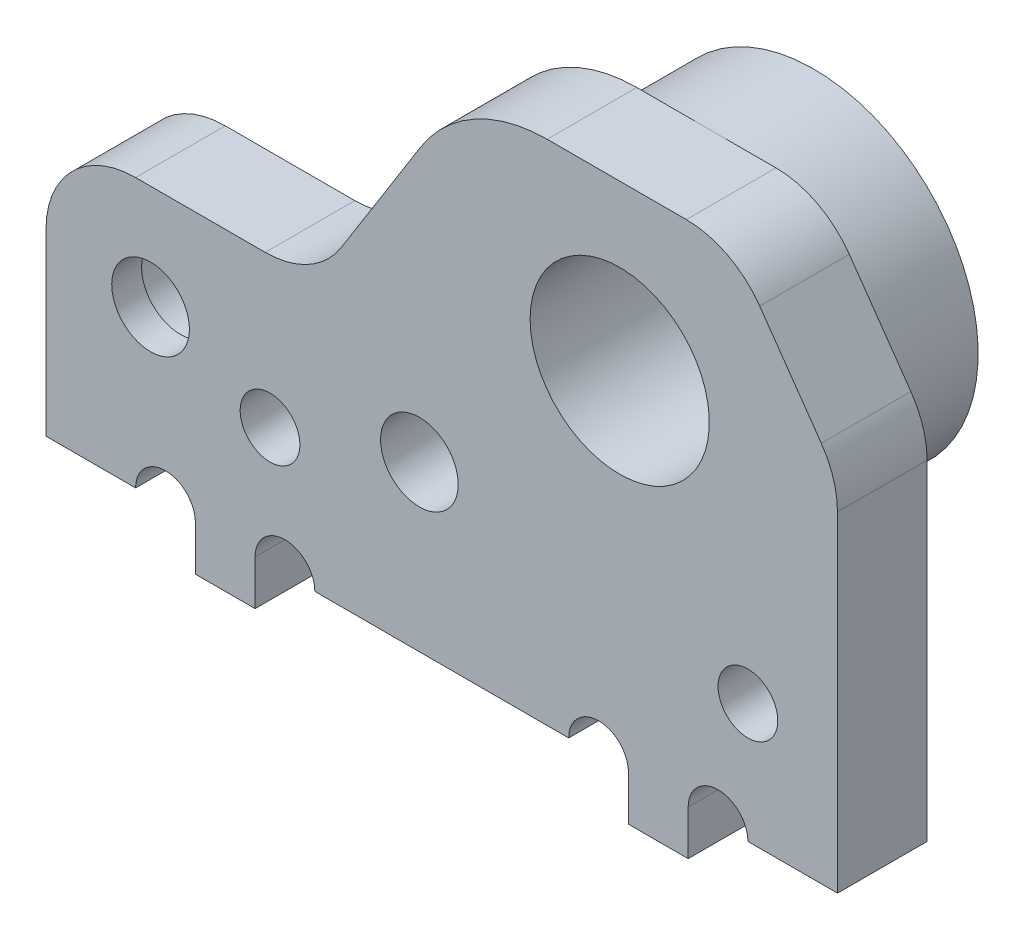
from build123d import *

# Parameters (mm, degrees)
SKETCH1_W                            = 26.5
SKETCH1_H                            = 6
BOSS_EXTRUDE1_DEPTH                  = 17
SKETCH2_R                            = 1.5
CUT_EXTRUDE1_DEPTH                   = 1
SKETCH3_R                            = 1.3
CUT_EXTRUDE2_DEPTH                   = 32.878676259
SKETCH4_R                            = 3
CUT_EXTRUDE3_DEPTH                   = 33.050741021
SKETCH5_R                            = 2.5
CUT_EXTRUDE4_DEPTH                   = 1.5
SKETCH6_R                            = 1.5
CUT_EXTRUDE8_DEPTH                   = 1
SKETCH7_R                            = 1.3
CUT_EXTRUDE9_DEPTH                   = 32.678068123
CUT_EXTRUDE10_START                  = -1
SKETCH8_R                            = 2.5
CUT_EXTRUDE10_DEPTH                  = 1
CUT_EXTRUDE11_START                  = -1
SKETCH9_R                            = 1.5
CUT_EXTRUDE11_DEPTH                  = 1
SKETCH10_R                           = 5.5
SKETCH10_R_2                         = 3
BOSS_EXTRUDE2_DEPTH                  = 3.5
SKETCH11_R                           = 3
SKETCH11_R_2                         = 1.3
BOSS_EXTRUDE4_DEPTH                  = 2
CUT_EXTRUDE12_START                  = -1
SKETCH12_R                           = 1.5
CUT_EXTRUDE12_DEPTH                  = 1
SKETCH17_W                           = 2
SKETCH17_H                           = 6
BOSS_EXTRUDE6_DEPTH                  = 1.5
SKETCH18_R                           = 1
CUT_EXTRUDE17_DEPTH                  = 33.050741021
CHAMFER2_SIZE                        = 5
CHAMFER2_SIZE2                       = 3.5
FILLET11_R                           = 3
BOSS_EXTRUDE7_DEPTH                  = 2
CUT_EXTRUDE19_DEPTH                  = 33.050741021
FILLET13_R                           = 5
FILLET14_R                           = 3
FILLET15_R                           = 3
SKIZZE1_R                            = 1
SCHNITT_LINEAR_AUSTRAGEN1_DEPTH      = 33.050741021
SCHNITT_LINEAR_AUSTRAGEN2_DEPTH      = 31.409702399
SCHNITT_LINEAR_AUSTRAGEN2_DEPTH_BACK = 31.409702399
SKIZZE2_W                            = 26.5
SKIZZE2_H                            = 3


with BuildPart() as part:
    # Sketch1 → Boss-Extrude1 (new body)
    with BuildSketch(Plane(origin=(0, 0, 0), x_dir=(1, 0, 0), z_dir=(0, 1, 0))):
        with Locations((13.25, 3)):
            Rectangle(SKETCH1_W, SKETCH1_H)
    extrude(amount=BOSS_EXTRUDE1_DEPTH)

    # Sketch2 → Cut-Extrude1 (cut)
    with BuildSketch(Plane.XY):
        with Locations((12.5, 5.5)):
            Circle(SKETCH2_R)
    extrude(amount=-CUT_EXTRUDE1_DEPTH, mode=Mode.SUBTRACT)

    # Sketch3 → Cut-Extrude2 (cut, through all)
    with BuildSketch(Plane.XY.offset(-1)):
        with Locations((12.5, 5.5)):
            Circle(SKETCH3_R)
    extrude(amount=-CUT_EXTRUDE2_DEPTH, mode=Mode.SUBTRACT)

    # Sketch4 → Cut-Extrude3 (cut, through all)
    with BuildSketch(Plane.XY):
        with Locations((19.208203932, 11.5)):
            Circle(SKETCH4_R)
    extrude(amount=-CUT_EXTRUDE3_DEPTH, mode=Mode.SUBTRACT)

    # Sketch5 → Cut-Extrude4 (cut)
    with BuildSketch(Plane.XY):
        with Locations((3.5, 5.5)):
            Circle(SKETCH5_R)
    extrude(amount=-CUT_EXTRUDE4_DEPTH, mode=Mode.SUBTRACT)

    # Sketch6 → Cut-Extrude8 (cut)
    with BuildSketch(Plane.XY.offset(-1.5)):
        with Locations((3.5, 5.5)):
            Circle(SKETCH6_R)
    extrude(amount=-CUT_EXTRUDE8_DEPTH, mode=Mode.SUBTRACT)

    # Sketch7 → Cut-Extrude9 (cut, through all)
    with BuildSketch(Plane.XY.offset(-2.5)):
        with Locations((3.5, 5.5)):
            Circle(SKETCH7_R)
    extrude(amount=-CUT_EXTRUDE9_DEPTH, mode=Mode.SUBTRACT)

    # Sketch8 → Cut-Extrude10 (cut)
    with BuildSketch(Plane(origin=(0, 0, -6), x_dir=(-1, 0, 0), z_dir=(0, 0, -1)).offset(CUT_EXTRUDE10_START)):
        with Locations(Location((-3.5, 5.5, 0), (0, 0, 180))):
            Circle(SKETCH8_R)
    extrude(amount=CUT_EXTRUDE10_DEPTH, mode=Mode.SUBTRACT)

    # Sketch9 → Cut-Extrude11 (cut)
    with BuildSketch(Plane(origin=(0, 0, -5), x_dir=(-1, 0, 0), z_dir=(0, 0, -1)).offset(CUT_EXTRUDE11_START)):
        with Locations(Location((-3.5, 5.5, 0), (0, 0, 180))):
            Circle(SKETCH9_R)
    extrude(amount=CUT_EXTRUDE11_DEPTH, mode=Mode.SUBTRACT)

    # Sketch10 → Boss-Extrude2 (add)
    with BuildSketch(Plane(origin=(0, 0, -6), x_dir=(-1, 0, 0), z_dir=(0, 0, -1))):
        with Locations(Location((-19.208203932, 11.5, 0), (0, 0, 90))):
            Circle(SKETCH10_R)
        with Locations(Location((-19.208203932, 11.5, 0), (0, 0, 180))):
            Circle(SKETCH10_R_2, mode=Mode.SUBTRACT)
    extrude(amount=BOSS_EXTRUDE2_DEPTH)

    # Sketch11 → Boss-Extrude4 (add)
    with BuildSketch(Plane(origin=(0, 0, -6), x_dir=(-1, 0, 0), z_dir=(0, 0, -1))):
        with Locations(Location((-12.5, 5.5, 0), (0, 0, 180))):
            Circle(SKETCH11_R)
        with Locations(Location((-12.5, 5.5, 0), (0, 0, 180))):
            Circle(SKETCH11_R_2, mode=Mode.SUBTRACT)
    extrude(amount=BOSS_EXTRUDE4_DEPTH)

    # Sketch12 → Cut-Extrude12 (cut)
    with BuildSketch(Plane(origin=(0, 0, -8), x_dir=(-1, 0, 0), z_dir=(0, 0, -1)).offset(CUT_EXTRUDE12_START)):
        with Locations(Location((-12.5, 5.5, 0), (0, 0, 180))):
            Circle(SKETCH12_R)
    extrude(amount=CUT_EXTRUDE12_DEPTH, mode=Mode.SUBTRACT)

    # Sketch17 → Boss-Extrude6 (add)
    with BuildSketch(Plane.XZ):
        with Locations((6, -3)):
            Rectangle(SKETCH17_W, SKETCH17_H)
        with Locations((20.5, -3)):
            Rectangle(SKETCH17_W, SKETCH17_H)
    extrude(amount=BOSS_EXTRUDE6_DEPTH)

    # Sketch18 → Cut-Extrude17 (cut, through all)
    with BuildSketch(Plane(origin=(0, 0, -6), x_dir=(-1, 0, 0), z_dir=(0, 0, -1))):
        with Locations((-22.5, 0)):
            Circle(SKETCH18_R)
        with Locations((-18.5, 0)):
            Circle(SKETCH18_R)
        with Locations((-8, 0)):
            Circle(SKETCH18_R)
        with Locations((-4, 0)):
            Circle(SKETCH18_R)
    extrude(amount=-CUT_EXTRUDE17_DEPTH, mode=Mode.SUBTRACT)

    # Chamfer2
    chamfer2_edges = [part.edges().sort_by_distance(p)[0] for p in [
        (26.5, 17, -3),
    ]]
    chamfer2_side = [part.faces().sort_by_distance(p)[0] for p in [
        (26.5, 8.5, -3),
    ]]
    chamfer(chamfer2_edges, length=CHAMFER2_SIZE, length2=CHAMFER2_SIZE2, reference=chamfer2_side[0])

    # Fillet11
    fillet11_edges = [part.edges().sort_by_distance(p)[0] for p in [
        (23, 17, -3),
        (26.5, 12, -3),
    ]]
    fillet(fillet11_edges, radius=FILLET11_R)

    # Sketch19 → Boss-Extrude7 (add)
    with BuildSketch(Plane(origin=(0, 0, -6), x_dir=(-1, 0, 0), z_dir=(0, 0, -1))):
        with BuildLine():
            Line((-14.547099294, 14.419606745), (-9.957579288, 7.09251277))
            ThreePointArc((-9.957579288, 7.09251277), (-14.736067977, 7.5), (-13.800160725, 2.796376119))
            Line((-13.800160725, 2.796376119), (-21.591831928, 6.543356218))
            ThreePointArc((-21.591831928, 6.543356218), (-15.108745974, 7.833333333), (-14.547099294, 14.419606745))
        make_face()
    extrude(amount=BOSS_EXTRUDE7_DEPTH)

    # Sketch20 → Cut-Extrude19 (cut, through all)
    with BuildSketch(Plane(origin=(0, 0, -6), x_dir=(-1, 0, 0), z_dir=(0, 0, -1))):
        Polygon((0, 17), (-14.011012575, 17), (-9, 9), (0, 9), align=None)
    extrude(amount=-CUT_EXTRUDE19_DEPTH, mode=Mode.SUBTRACT)

    # Fillet13
    fillet13_edges = [part.edges().sort_by_distance(p)[0] for p in [
        (14.011012575, 17, -3),
    ]]
    fillet(fillet13_edges, radius=FILLET13_R)

    # Fillet14
    fillet14_edges = [part.edges().sort_by_distance(p)[0] for p in [
        (9, 9, -3),
    ]]
    fillet(fillet14_edges, radius=FILLET14_R)

    # Fillet15
    fillet15_edges = [part.edges().sort_by_distance(p)[0] for p in [
        (0, 9, -3),
    ]]
    fillet(fillet15_edges, radius=FILLET15_R)

    # Skizze1 → Schnitt-Linear austragen1 (cut, through all)
    with BuildSketch(Plane(origin=(0, 0, -6), x_dir=(-1, 0, 0), z_dir=(0, 0, -1))):
        with Locations((-23.5, 4)):
            Circle(SKIZZE1_R)
        with Locations((-7.5, 4)):
            Circle(SKIZZE1_R)
    extrude(amount=-SCHNITT_LINEAR_AUSTRAGEN1_DEPTH, mode=Mode.SUBTRACT)

    # Skizze2 → Schnitt-Linear austragen2 (cut, two sides: drawn at the far end of the back side and taken through both)
    with BuildSketch(Plane(origin=(0, 5.5, 0), x_dir=(1, 0, 0), z_dir=(0, 1, 0)).offset(-SCHNITT_LINEAR_AUSTRAGEN2_DEPTH_BACK)):
        with Locations((13.25, 1.5)):
            Rectangle(SKIZZE2_W, SKIZZE2_H)
    extrude(amount=SCHNITT_LINEAR_AUSTRAGEN2_DEPTH + SCHNITT_LINEAR_AUSTRAGEN2_DEPTH_BACK, mode=Mode.SUBTRACT)


solid = part.part
